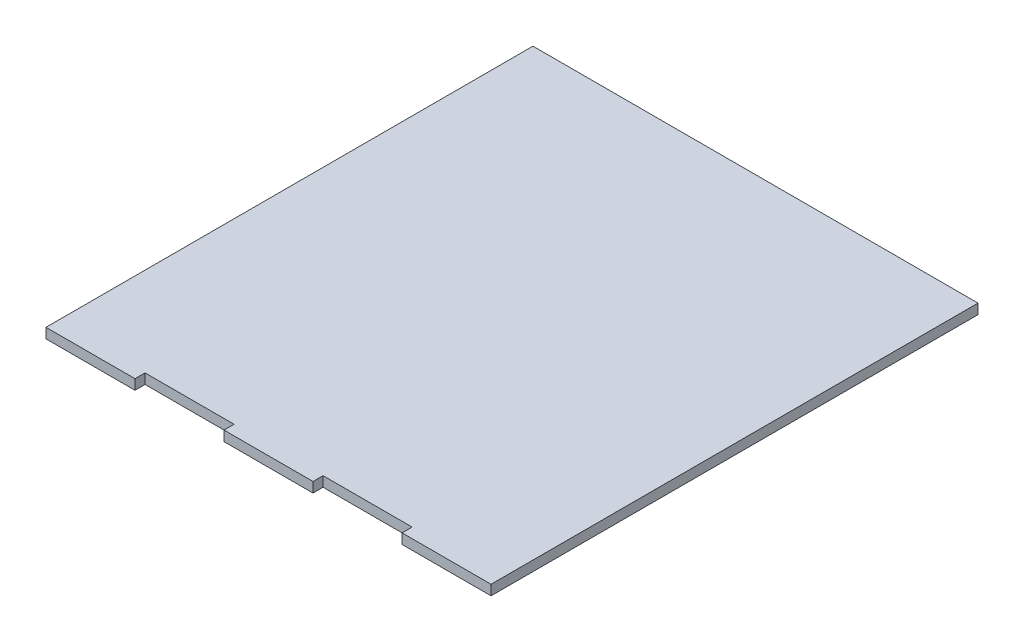
from build123d import *

# Parameters (mm, degrees)
SKETCH1_W           = 369.1255
SKETCH1_H           = 403.89048
BOSS_EXTRUDE1_DEPTH = 8.3312
SKETCH2_W           = 73.8251
SKETCH2_H           = 8.3312
CUT_EXTRUDE1_DEPTH  = 506.599381549


with BuildPart() as part:
    # Sketch1 → Boss-Extrude1 (new body)
    with BuildSketch(Plane(origin=(0, 0, 0), x_dir=(1, 0, 0), z_dir=(0, 1, 0))):
        with Locations((114.841756772, 205.385420587)):
            Rectangle(SKETCH1_W, SKETCH1_H)
    extrude(amount=BOSS_EXTRUDE1_DEPTH)

    # Sketch2 → Cut-Extrude1 (cut, through all)
    with BuildSketch(Plane.XZ):
        with Locations((188.666856772, -7.605780587)):
            Rectangle(SKETCH2_W, SKETCH2_H)
        with Locations((41.016656772, -7.605780587)):
            Rectangle(SKETCH2_W, SKETCH2_H)
    extrude(amount=-CUT_EXTRUDE1_DEPTH, mode=Mode.SUBTRACT)


solid = part.part
